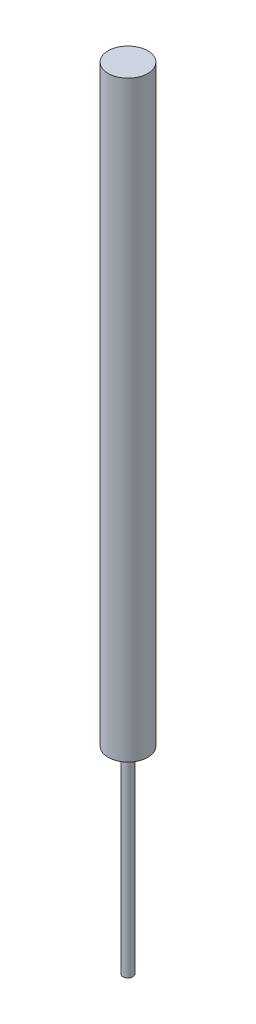
from build123d import *

# Parameters (mm, degrees)
SKETCH1_R           = 0.25
BOSS_EXTRUDE1_DEPTH = 10
SKETCH2_R           = 1
BOSS_EXTRUDE2_DEPTH = 30


with BuildPart() as part:
    # Sketch1 → Boss-Extrude1 (new body)
    with BuildSketch(Plane(origin=(0, 0, 0), x_dir=(1, 0, 0), z_dir=(0, 1, 0))):
        with Locations(Location((0, 0, 0), (0, 0, 270))):
            Circle(SKETCH1_R)
    extrude(amount=BOSS_EXTRUDE1_DEPTH)

    # Sketch2 → Boss-Extrude2 (add)
    with BuildSketch(Plane(origin=(0, 10, 0), x_dir=(1, 0, 0), z_dir=(0, 1, 0))):
        with Locations(Location((0, 0, 0), (0, 0, 270))):
            Circle(SKETCH2_R)
    extrude(amount=BOSS_EXTRUDE2_DEPTH)


solid = part.part
